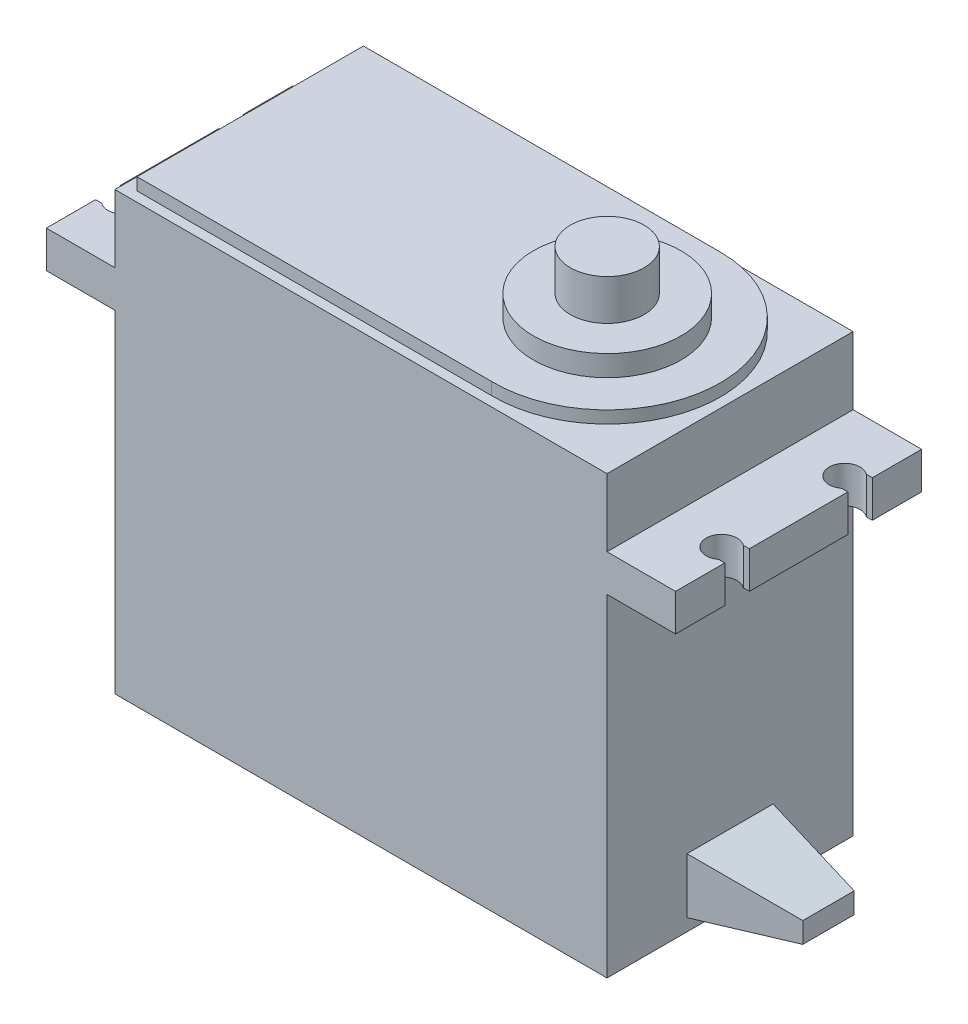
from build123d import *

# Parameters (mm, degrees)
RESSALTO_EXTRUS_O1_DEPTH = 10
CORTE_EXTRUS_O1_DEPTH    = 10
RESSALTO_EXTRUS_O2_DEPTH = 1
ESBO_O4_R                = 3
RESSALTO_EXTRUS_O3_DEPTH = 5
ESBO_O5_R                = 6
RESSALTO_EXTRUS_O4_DEPTH = 1.7
ESBO_O7_W                = 7
ESBO_O7_H                = 4.5
RESSALTO_EXTRUS_O5_DEPTH = 8
RESSALTO_EXTRUS_O5_TAPER = 10


with BuildPart() as part:
    # Esboço1 → Ressalto-extrusão1 (new, symmetric)
    with BuildSketch(Plane.XY):
        Polygon((20, -0.767915455), (25.568877633, -0.767915455), (25.568877633, -3.767915455), (20, -3.767915455), (20, -30.767915455), (-20, -30.767915455), (-20, -3.767915455), (-25.568877633, -3.767915455), (-25.568877633, -0.767915455), (-20, -0.767915455), (-20, 4.732084545), (20, 4.732084545), align=None)
    extrude(amount=RESSALTO_EXTRUS_O1_DEPTH, both=True)

    # Esboço6 → Corte-extrusão1 (cut)
    with BuildSketch(Plane(origin=(0, -0.767915455, 0), x_dir=(1, 0, 0), z_dir=(0, 1, 0))):
        with BuildLine():
            Line((25.071445053, 4), (25.568877633, 4))
            Line((25.568877633, 4), (25.568877633, 6))
            Line((25.568877633, 6), (25.071445053, 6))
            ThreePointArc((25.071445053, 6), (23.061122367, 5), (25.071445053, 4))
        make_face()
        with BuildLine():
            Line((25.568877633, -6), (25.568877633, -4))
            Line((25.568877633, -4), (25.071445053, -4))
            ThreePointArc((25.071445053, -4), (23.061122367, -5), (25.071445053, -6))
            Line((25.071445053, -6), (25.568877633, -6))
        make_face()
        with BuildLine():
            ThreePointArc((-25.071445053, 6), (-23.061122367, 5), (-25.071445053, 4))
            Line((-25.071445053, 4), (-25.568877633, 4))
            Line((-25.568877633, 4), (-25.568877633, 6))
            Line((-25.568877633, 6), (-25.071445053, 6))
        make_face()
        with BuildLine():
            ThreePointArc((-25.071445053, -4), (-23.061122367, -5), (-25.071445053, -6))
            Line((-25.071445053, -6), (-25.568877633, -6))
            Line((-25.568877633, -6), (-25.568877633, -4))
            Line((-25.568877633, -4), (-25.071445053, -4))
        make_face()
    extrude(amount=-CORTE_EXTRUS_O1_DEPTH, mode=Mode.SUBTRACT)

    # Esboço3 → Ressalto-extrusão2 (add)
    with BuildSketch(Plane(origin=(0, 4.732084545, 0), x_dir=(1, 0, 0), z_dir=(0, 1, 0))):
        with BuildLine():
            Line((-19, 9.202511885), (10.015, 9.202511885))
            ThreePointArc((10.015, 9.202511885), (19.216883893, -0.107507336), (9.8, -9.2))
            Line((9.8, -9.2), (-19, -9.2))
            Line((-19, -9.2), (-19, 9.202511885))
        make_face()
    extrude(amount=RESSALTO_EXTRUS_O2_DEPTH)

    # Esboço4 → Ressalto-extrusão3 (add)
    with BuildSketch(Plane(origin=(0, 5.732084545, 0), x_dir=(1, 0, 0), z_dir=(0, 1, 0))):
        with Locations(Location((10.015, 0, 0), (0, 0, 180))):
            Circle(ESBO_O4_R)
    extrude(amount=RESSALTO_EXTRUS_O3_DEPTH)

    # Esboço5 → Ressalto-extrusão4 (add)
    with BuildSketch(Plane(origin=(0, 5.732084545, 0), x_dir=(1, 0, 0), z_dir=(0, 1, 0))):
        with Locations(Location((10.015, 0, 0), (0, 0, 180))):
            Circle(ESBO_O5_R)
    extrude(amount=RESSALTO_EXTRUS_O4_DEPTH)

    # Esboço7 → Ressalto-extrusão5 (add)
    with BuildSketch(Plane(origin=(20, 0, 0), x_dir=(0, 0, -1), z_dir=(1, 0, 0))):
        with Locations((0, -27.517915455)):
            Rectangle(ESBO_O7_W, ESBO_O7_H)
    extrude(amount=RESSALTO_EXTRUS_O5_DEPTH, taper=RESSALTO_EXTRUS_O5_TAPER)


solid = part.part
